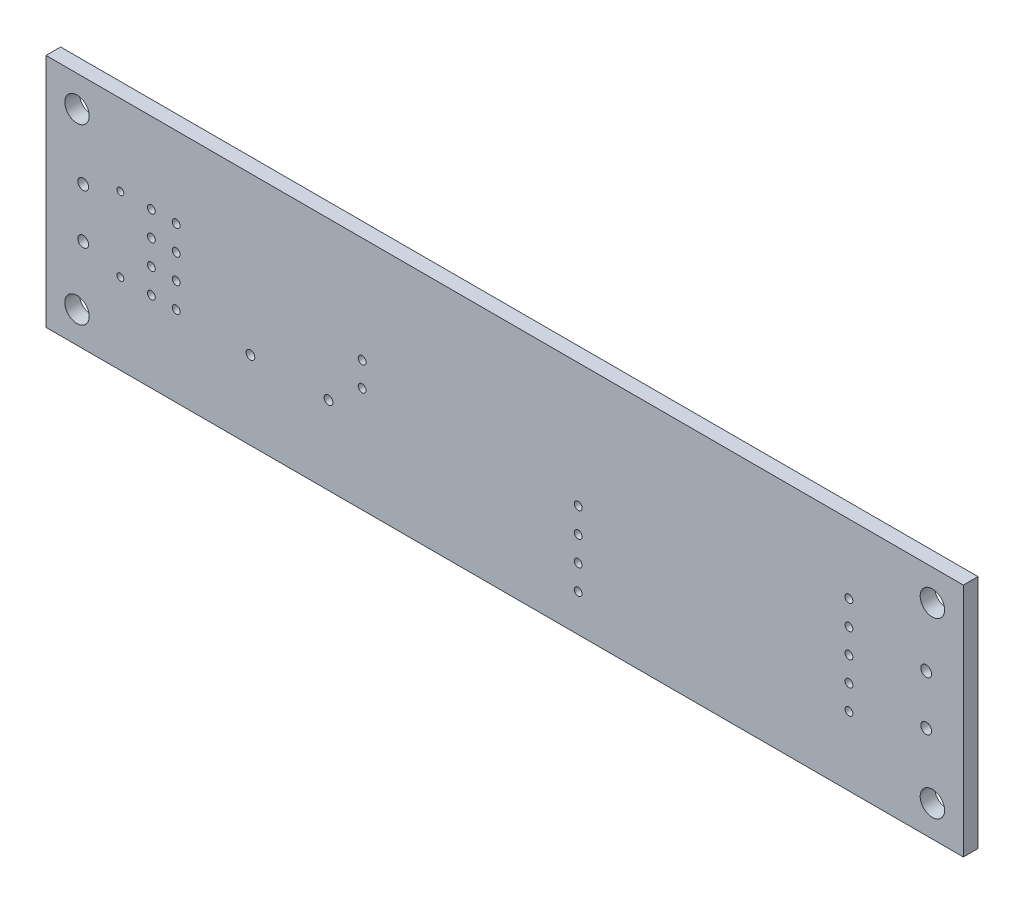
from build123d import *

# Parameters (mm, degrees)
SKETCH_1_W      = 93.979995727
SKETCH_1_H      = 24.130004883
SKETCH_1_R      = 1.25000004
SKETCH_1_R_2    = 0.3999992
SKETCH_1_R_3    = 0.5499989
SKETCH_1_R_4    = 0.4499991
SKETCH_1_R_5    = 0.3499993
EXTRUDE_1_DEPTH = 1.5


with BuildPart() as part:
    # Эскиз1 → Бобышка-Вытянуть1 (new body)
    with BuildSketch(Plane(origin=(0, 0, -0.34544), x_dir=(-1, 0, 0), z_dir=(0, 0, -1))):
        with Locations((-119.379997253, 83.819999695)):
            Rectangle(SKETCH_1_W, SKETCH_1_H)
        with Locations(Location((-163.195, 92.71, 0), (0, 0, 180))):
            Circle(SKETCH_1_R, mode=Mode.SUBTRACT)
        with Locations(Location((-154.6499828, 88.81999, 0), (0, 0, 180))):
            Circle(SKETCH_1_R_2, mode=Mode.SUBTRACT)
        with Locations(Location((-162.56, 86.36, 0), (0, 0, 180))):
            Circle(SKETCH_1_R_3, mode=Mode.SUBTRACT)
        with Locations(Location((-154.6499828, 86.3200204, 0), (0, 0, 180))):
            Circle(SKETCH_1_R_2, mode=Mode.SUBTRACT)
        with Locations(Location((-154.6499828, 83.82, 0), (0, 0, 180))):
            Circle(SKETCH_1_R_2, mode=Mode.SUBTRACT)
        with Locations(Location((-104.775, 85.05001786, 0), (0, 0, 180))):
            Circle(SKETCH_1_R_2, mode=Mode.SUBTRACT)
        with Locations(Location((-126.907544, 83.185, 0), (0, 0, 180))):
            Circle(SKETCH_1_R_2, mode=Mode.SUBTRACT)
        with Locations(Location((-104.77500254, 82.55, 0), (0, 0, 180))):
            Circle(SKETCH_1_R_2, mode=Mode.SUBTRACT)
        with Locations(Location((-162.56, 81.28, 0), (0, 0, 180))):
            Circle(SKETCH_1_R_3, mode=Mode.SUBTRACT)
        with Locations(Location((-154.6499828, 81.3199796, 0), (0, 0, 180))):
            Circle(SKETCH_1_R_2, mode=Mode.SUBTRACT)
        with Locations(Location((-163.195, 74.93, 0), (0, 0, 180))):
            Circle(SKETCH_1_R, mode=Mode.SUBTRACT)
        with Locations(Location((-154.6499828, 78.82001, 0), (0, 0, 180))):
            Circle(SKETCH_1_R_2, mode=Mode.SUBTRACT)
        with Locations(Location((-126.907544, 80.645, 0), (0, 0, 180))):
            Circle(SKETCH_1_R_2, mode=Mode.SUBTRACT)
        with Locations(Location((-101.329998, 79.7799776, 0), (0, 0, 180))):
            Circle(SKETCH_1_R_4, mode=Mode.SUBTRACT)
        with Locations(Location((-126.907544, 75.565, 0), (0, 0, 180))):
            Circle(SKETCH_1_R_2, mode=Mode.SUBTRACT)
        with Locations(Location((-126.907544, 78.105, 0), (0, 0, 180))):
            Circle(SKETCH_1_R_2, mode=Mode.SUBTRACT)
        with Locations(Location((-85.725, 87.63, 0), (0, 0, 180))):
            Circle(SKETCH_1_R_2, mode=Mode.SUBTRACT)
        with Locations(Location((-83.185, 87.63, 0), (0, 0, 180))):
            Circle(SKETCH_1_R_2, mode=Mode.SUBTRACT)
        with Locations(Location((-85.725, 82.55, 0), (0, 0, 180))):
            Circle(SKETCH_1_R_2, mode=Mode.SUBTRACT)
        with Locations(Location((-85.725, 85.09, 0), (0, 0, 180))):
            Circle(SKETCH_1_R_2, mode=Mode.SUBTRACT)
        with Locations(Location((-80.01, 87.63, 0), (0, 0, 180))):
            Circle(SKETCH_1_R_5, mode=Mode.SUBTRACT)
        with Locations(Location((-75.565, 92.71, 0), (0, 0, 180))):
            Circle(SKETCH_1_R, mode=Mode.SUBTRACT)
        with Locations(Location((-83.185, 85.09, 0), (0, 0, 180))):
            Circle(SKETCH_1_R_2, mode=Mode.SUBTRACT)
        with Locations(Location((-76.2, 86.36, 0), (0, 0, 180))):
            Circle(SKETCH_1_R_3, mode=Mode.SUBTRACT)
        with Locations(Location((-85.725, 80.01, 0), (0, 0, 180))):
            Circle(SKETCH_1_R_2, mode=Mode.SUBTRACT)
        with Locations(Location((-83.185, 82.55, 0), (0, 0, 180))):
            Circle(SKETCH_1_R_2, mode=Mode.SUBTRACT)
        with Locations(Location((-93.330014, 79.7799776, 0), (0, 0, 180))):
            Circle(SKETCH_1_R_4, mode=Mode.SUBTRACT)
        with Locations(Location((-83.185, 80.01, 0), (0, 0, 180))):
            Circle(SKETCH_1_R_2, mode=Mode.SUBTRACT)
        with Locations(Location((-80.01, 80.0300152, 0), (0, 0, 180))):
            Circle(SKETCH_1_R_5, mode=Mode.SUBTRACT)
        with Locations(Location((-76.2, 81.28, 0), (0, 0, 180))):
            Circle(SKETCH_1_R_3, mode=Mode.SUBTRACT)
        with Locations(Location((-75.565, 74.93, 0), (0, 0, 180))):
            Circle(SKETCH_1_R, mode=Mode.SUBTRACT)
    extrude(amount=-EXTRUDE_1_DEPTH)


solid = part.part
